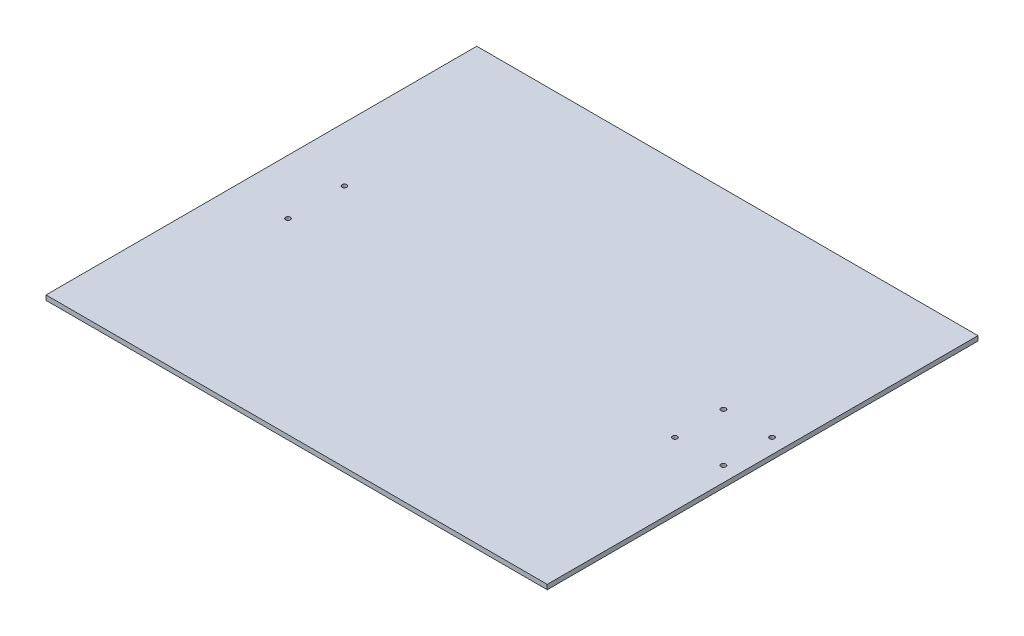
from build123d import *

# Parameters (mm, degrees)
SKETCH1_W                      = 320
SKETCH1_H                      = 275
BOSS_EXTRUDE1_DEPTH            = 3
TALADRO_DE_MARGEN_PARA_M2_51_D = 3.1
SKETCH6_R                      = 1.5
CUT_EXTRUDE1_DEPTH             = 211.986373968


with BuildPart() as part:
    # Sketch1 → Boss-Extrude1 (new body)
    with BuildSketch(Plane(origin=(0, 0, 0), x_dir=(1, 0, 0), z_dir=(0, 1, 0))):
        Rectangle(SKETCH1_W, SKETCH1_H)
    extrude(amount=BOSS_EXTRUDE1_DEPTH)

    # Taladro de margen para M2.51 (through all)
    with Locations(Plane(origin=(0, 3, 0), x_dir=(1, 0, 0), z_dir=(0, 1, 0))):
        with Locations((150.5, 15.5), (150.5, -15.5), (119.5, -15.5), (119.5, 15.5)):
            Hole(TALADRO_DE_MARGEN_PARA_M2_51_D / 2)

    # Sketch6 → Cut-Extrude1 (cut, through all)
    with BuildSketch(Plane(origin=(0, 3, 0), x_dir=(1, 0, 0), z_dir=(0, 1, 0))):
        with Locations(Location((-125, -18, 0), (0, 0, 270))):
            Circle(SKETCH6_R)
        with Locations(Location((-125, 18, 0), (0, 0, 270))):
            Circle(SKETCH6_R)
    extrude(amount=-CUT_EXTRUDE1_DEPTH, mode=Mode.SUBTRACT)


solid = part.part
